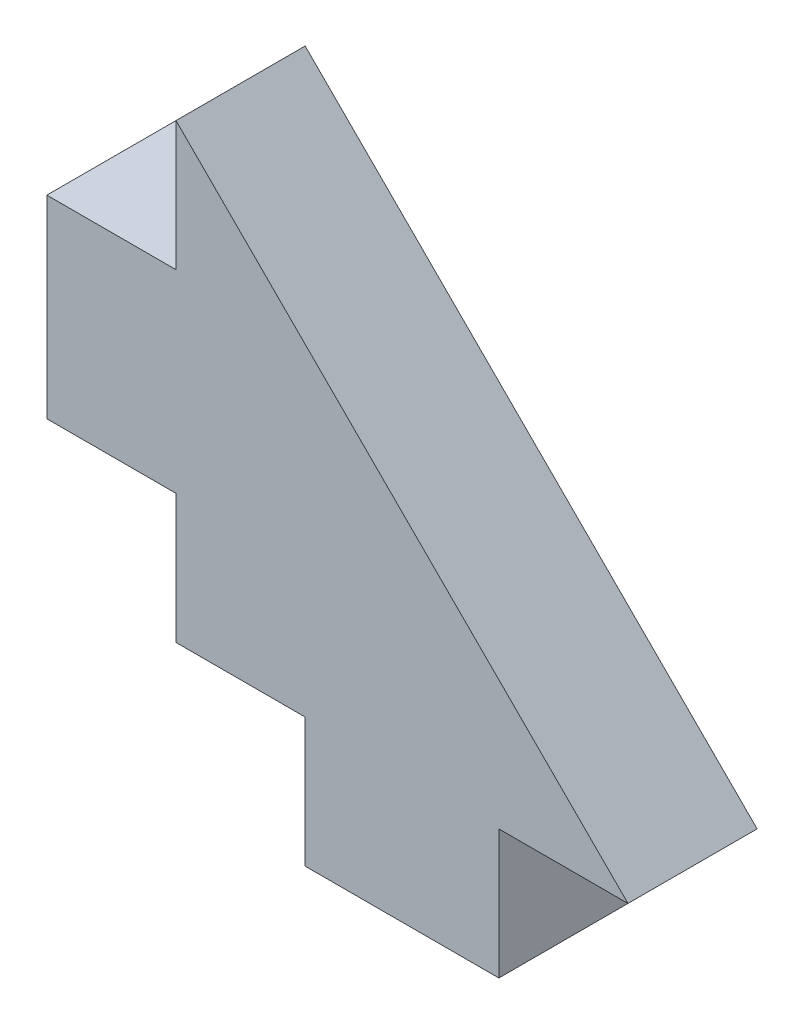
from build123d import *

# Parameters (mm, degrees)
BOSS_EXTRUDE1_DEPTH = 5.08


with BuildPart() as part:
    # Sketch1 → Boss-Extrude1 (new body)
    with BuildSketch(Plane.XY):
        Polygon((0, 0), (5.08, 0), (5.08, -5.08), (12.7, -5.08), (12.7, 0), (17.78, 0), (0, 17.78), (0, 12.7), (-5.08, 12.7), (-5.08, 5.08), (0, 5.08), align=None)
    extrude(amount=BOSS_EXTRUDE1_DEPTH)


solid = part.part
